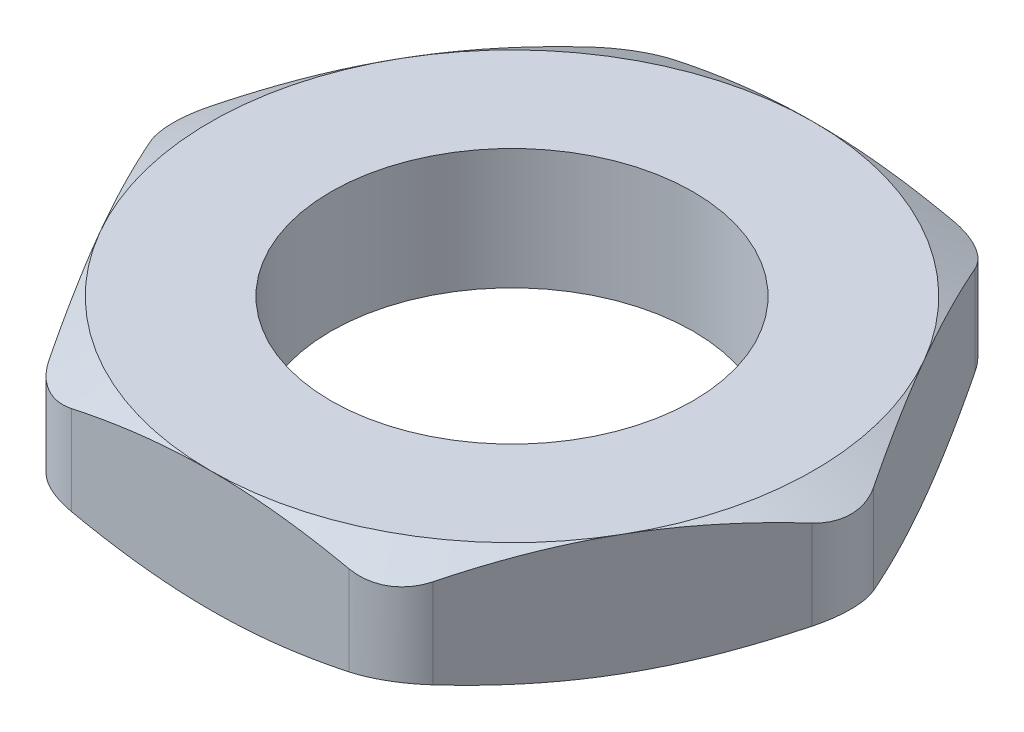
from build123d import *

# Parameters (mm, degrees)
BOSS_EXTRUDE1_DEPTH   = 2
M7X1_0_TAPPED_HOLE1_D = 6
FILLET1_R             = 1.016


with BuildPart() as part:
    # Sketch1 → Boss-Extrude1 (new body)
    with BuildSketch(Plane(origin=(0, 0, 0), x_dir=(1, 0, 0), z_dir=(0, 1, 0))):
        Polygon((-2.886751346, 5), (-5.773502692, 0), (-2.886751346, -5), (2.886751346, -5), (5.773502692, 0), (2.886751346, 5), align=None)
    extrude(amount=BOSS_EXTRUDE1_DEPTH)

    # M7x1.0 Tapped Hole1 (through all)
    with Locations(Plane(origin=(0, 2, 0), x_dir=(1, 0, 0), z_dir=(0, 1, 0))):
        with Locations((0, 0)):
            Hole(M7X1_0_TAPPED_HOLE1_D / 2)

    # Sketch4 → Cut-Revolve1 (revolve, cut)
    with BuildSketch(Plane.XY):
        Polygon((5.773502692, 1.6), (5.773502692, 2), (5, 2), align=None)
        Polygon((5, 0), (5.773502692, 0), (5.773502692, 0.4), align=None)
    revolve(axis=Axis((0, 0, 0), (0, 1, 0)), mode=Mode.SUBTRACT)

    # Fillet1
    fillet1_edges = [part.edges().sort_by_distance(p)[0] for p in [
        (2.886751346, 1, 5),
        (-2.886751346, 1, 5),
        (-5.773502692, 1, 0),
        (-2.886751346, 1, -5),
        (2.886751346, 1, -5),
        (5.773502692, 1, 0),
    ]]
    fillet(fillet1_edges, radius=FILLET1_R)


solid = part.part
